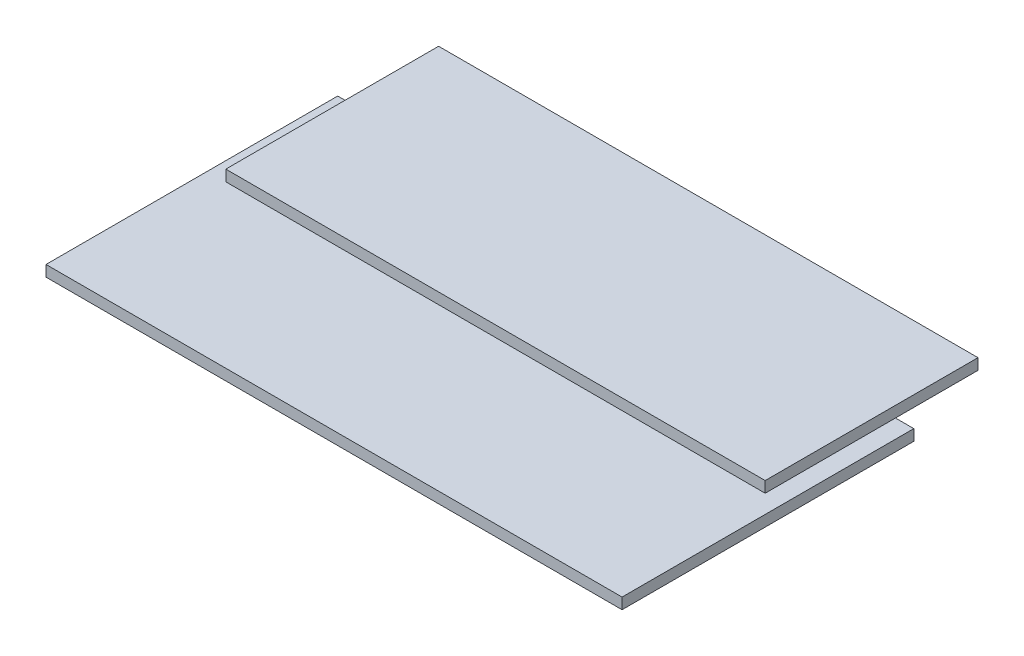
from build123d import *

# Parameters (mm, degrees)
SKETCH2_W           = 78.5
SKETCH2_H           = 39.753650764
BOSS_EXTRUDE1_DEPTH = 0.75
SKETCH3_W           = 73.5
SKETCH3_H           = 29
BOSS_EXTRUDE2_DEPTH = 1.5


with BuildPart() as part:
    # Sketch2 → Boss-Extrude1 (new, symmetric)
    with BuildSketch(Plane(origin=(0, 0, 0), x_dir=(1, 0, 0), z_dir=(0, 1, 0))):
        Rectangle(SKETCH2_W, SKETCH2_H)
    extrude(amount=BOSS_EXTRUDE1_DEPTH, both=True)

    # Sketch3 → Boss-Extrude2 (add)
    with BuildSketch(Plane(origin=(0, 0.75, 0), x_dir=(1, 0, 0), z_dir=(0, 1, 0))):
        with Locations((0, 16.623174618)):
            Rectangle(SKETCH3_W, SKETCH3_H)
    extrude(amount=BOSS_EXTRUDE2_DEPTH)


solid = part.part
